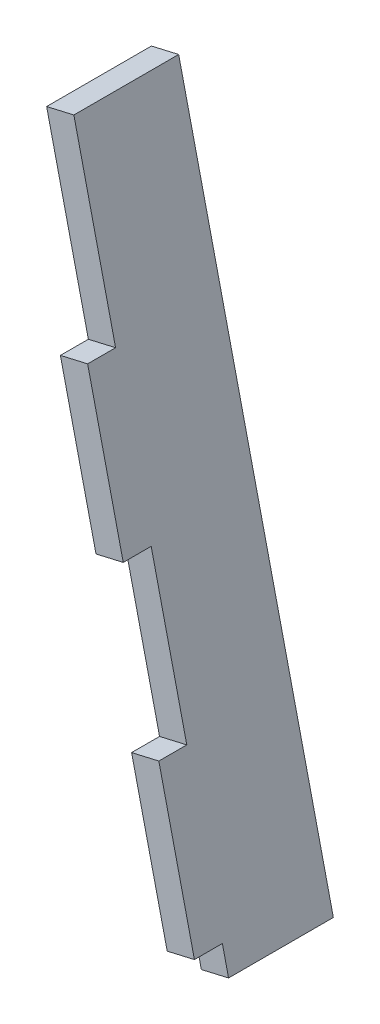
from build123d import *

# Parameters (mm, degrees)
BOSS_EXTRUDE1_DEPTH   = 10.16
BOSS_EXTRUDE1_2_DEPTH = 10.16
BOSS_EXTRUDE2_DEPTH   = 38.1


with BuildPart() as part:
    # Sketch1 → Boss-Extrude1 (new body)
    with BuildSketch(Plane.XY):
        Polygon((-120.524654614, 1641.945974367), (-107.584015199, 1585.893906943), (-117.483615058, 1583.608404231), (-130.424254473, 1639.660471655), align=None)
    extrude(amount=-BOSS_EXTRUDE1_DEPTH)



with BuildPart() as body_2:
    # Sketch1 → Boss-Extrude1 2 (new body)
    with BuildSketch(Plane.XY):
        Polygon((-104.542975642, 1527.556336807), (-94.643375784, 1529.841839519), (-81.702736369, 1473.789772095), (-91.602336227, 1471.504269383), align=None)
    extrude(amount=-BOSS_EXTRUDE1_2_DEPTH)


with BuildPart() as part_1:
    add(part.part)

    add(body_2.part)  # Boss-Extrude2 merges body 2
    # Sketch2 → Boss-Extrude2 (add)
    with BuildSketch(Plane(origin=(0, 0, -10.16), x_dir=(-1, 0, 0), z_dir=(0, 0, -1))):
        Polygon((145.59058927, 1705.353084931), (89.352825684, 1461.760568735), (79.453225826, 1464.046071447), (135.690989412, 1707.638587643), align=None)
    extrude(amount=BOSS_EXTRUDE2_DEPTH)


solid = part_1.part
